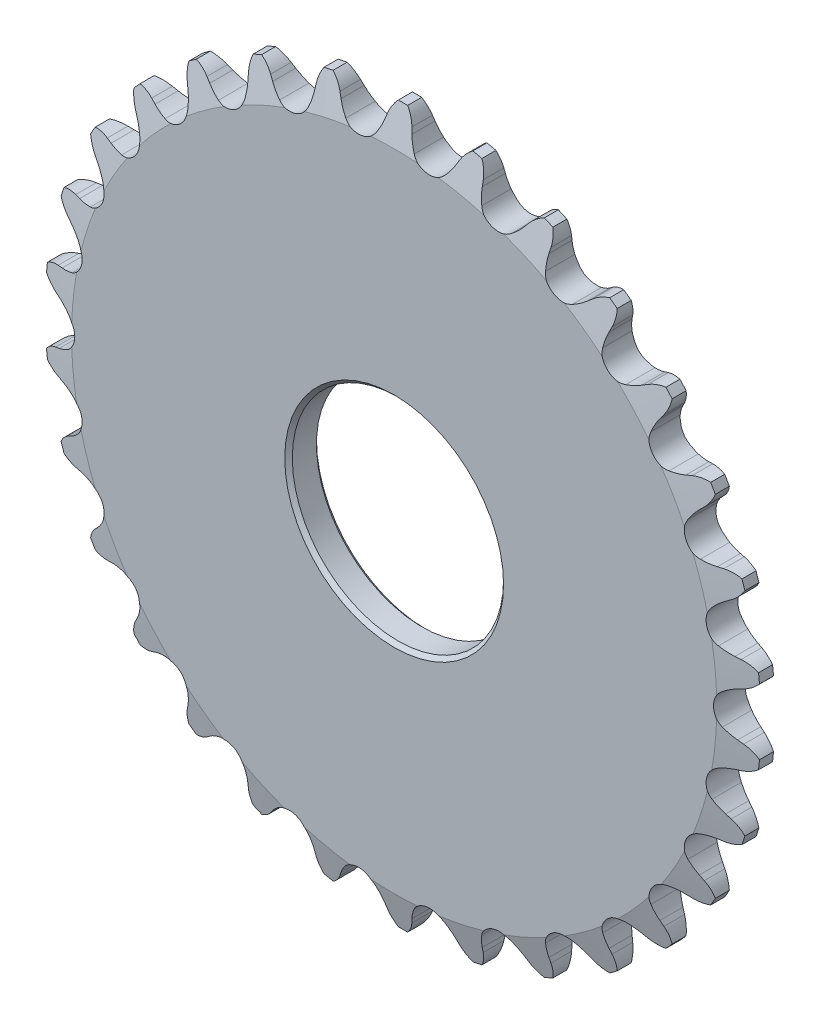
from build123d import *

# Parameters (mm, degrees)
CUT_EXTRUDE8_REACH = 70.256
CIRPATTERN1_COUNT  = 30
CHAFL_N2_SIZE      = 0.508


with BuildPart() as part:
    # Sketch16 → Revolve3 (revolve)
    with BuildSketch(Plane(origin=(0, 0, 0), x_dir=(0, 0, -1), z_dir=(1, 0, 0)), mode=Mode.PRIVATE) as revolve3_sk:
        Polygon((6.8453, 14.211564163), (11.1125, 14.211564163), (11.1125, 43.407160713), (9.921875, 48.169660713), (8.035925, 48.169660713), (6.8453, 43.407160713), (6.8453, 25.4), align=None)
    revolve(revolve3_sk.sketch.rotate(Axis((0, 0, 11.1125), (0, 0, -1)), 90), axis=Axis((0, 0, 11.1125), (0, 0, -1)))

    # Sketch18 → Cut-Extrude8 (cut, up to next)
    with BuildSketch(Plane(origin=(0, 0, -11.1125), x_dir=(-1, 0, 0), z_dir=(0, 0, -1)), mode=Mode.PRIVATE) as cut_extrude8_sk1:
        with BuildLine():
            Line((-1.635561592, -46.370021446), (-1.813993949, -45.697849854))
            ThreePointArc((-1.813993949, -45.697849854), (-2.117230845, -44.812167358), (-2.541750957, -43.977800069))
            ThreePointArc((-2.541750957, -43.977800069), (-4.491687657, -42.735553387), (-6.65729117, -43.545239362))
            ThreePointArc((-6.65729117, -43.545239362), (-7.246009213, -44.27311103), (-7.726763401, -45.076392743))
            Line((-7.726763401, -45.076392743), (-8.041048915, -45.6967776))
            ThreePointArc((-8.041048915, -45.6967776), (-10.036652317, -47.59769295), (-12.784007357, -47.816673302))
            ThreePointArc((-12.784007357, -47.816673302), (-5.173752511, -49.224966985), (2.563000729, -49.42970885))
            ThreePointArc((2.563000729, -49.42970885), (-0.078789437, -48.644306513), (-1.635561592, -46.370021446))
        make_face()
    cut_extrude8_tool1 = extrude(cut_extrude8_sk1.sketch, amount=-CUT_EXTRUDE8_REACH, mode=Mode.PRIVATE) & part.part
    cut_extrude8 = cut_extrude8_tool1.solids().sort_by_distance((4.905434, -46.672085, -11.1125))[0]
    add(cut_extrude8, mode=Mode.SUBTRACT)

    # CirPattern1: Cut-Extrude8 ×30 about axis
    cirpattern1_axis = Axis((0, 0, 0), (0, 0, 1))
    for i in range(1, CIRPATTERN1_COUNT):
        add(cut_extrude8.rotate(cirpattern1_axis, i * 360 / CIRPATTERN1_COUNT), mode=Mode.SUBTRACT)

    # Chaflán2
    chafl_n2_edges = [part.edges().sort_by_distance(p)[0] for p in [
        (-14.211564163, 0, -11.1125),
        (-14.211564163, 0, -6.8453),
    ]]
    chamfer(chafl_n2_edges, length=CHAFL_N2_SIZE)


solid = part.part
